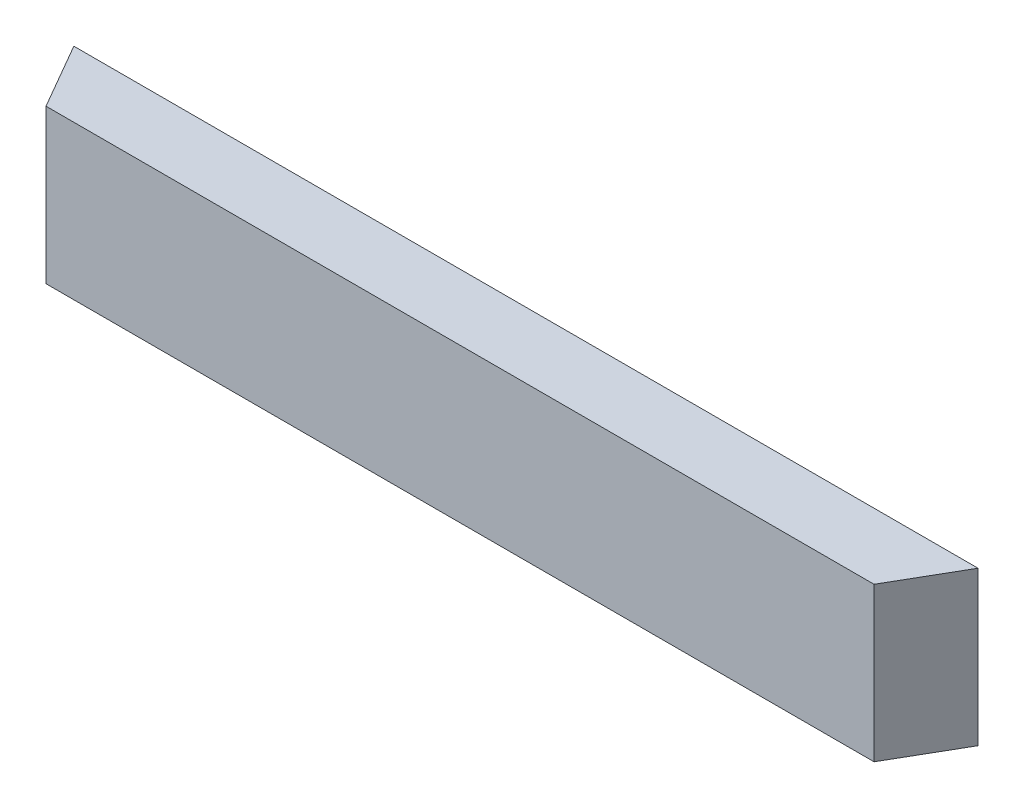
from build123d import *

# Parameters (mm, degrees)
BOSS_EXTRUDE1_DEPTH = 88.9


with BuildPart() as part:
    # Sketch1 → Boss-Extrude1 (new body)
    with BuildSketch(Plane(origin=(0, 0, 0), x_dir=(1, 0, 0), z_dir=(0, 1, 0))):
        Polygon((0, 0), (478.79, 0), (500.787045256, 38.1), (-21.997045256, 38.1), align=None)
    extrude(amount=BOSS_EXTRUDE1_DEPTH)


solid = part.part
